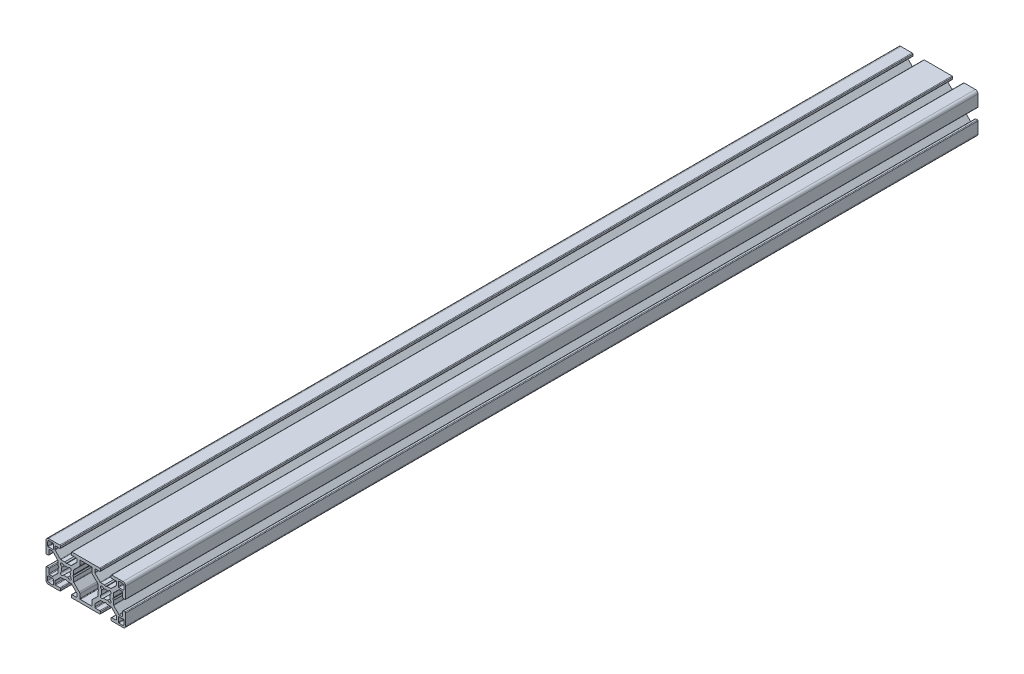
from build123d import *

# Parameters (mm, degrees)
EXTRUDE1_DEPTH = 642


with BuildPart() as part:
    # Sketch1 → Extrude1 (new body)
    with BuildSketch(Plane.XY):
        with BuildLine():
            Line((-10.428, -15), (10.428, -15))
            ThreePointArc((10.428, -15), (10.787210245, -14.851210245), (10.936, -14.492))
            Line((10.936, -14.492), (10.936, -13.2982))
            ThreePointArc((10.936, -13.2982), (10.787210245, -12.938989755), (10.428, -12.7902))
            Line((10.428, -12.7902), (7.253, -12.7902))
            ThreePointArc((7.253, -12.7902), (6.893789755, -12.641410245), (6.745, -12.2822))
            Line((6.745, -12.2822), (6.745, -10.261471714))
            ThreePointArc((6.745, -10.261471714), (6.783669197, -10.06706853), (6.893789755, -9.902261469))
            Line((6.893789755, -9.902261469), (10.825246067, -5.970805157))
            ThreePointArc((10.825246067, -5.970805157), (10.990053129, -5.860684599), (11.184456312, -5.822015402))
            Line((11.184456312, -5.822015402), (14.0475, -5.822015402))
            Line((14.0475, -5.822015402), (15, -5.314015402))
            Line((15, -5.314015402), (15.9525, -5.822015402))
            Line((15.9525, -5.822015402), (18.815543688, -5.822015402))
            ThreePointArc((18.815543688, -5.822015402), (19.009946871, -5.860684599), (19.174753933, -5.970805157))
            Line((19.174753933, -5.970805157), (23.106210245, -9.902261469))
            ThreePointArc((23.106210245, -9.902261469), (23.216330803, -10.06706853), (23.255, -10.261471714))
            Line((23.255, -10.261471714), (23.255, -12.2822))
            ThreePointArc((23.255, -12.2822), (23.106210245, -12.641410245), (22.747, -12.7902))
            Line((22.747, -12.7902), (19.572, -12.7902))
            ThreePointArc((19.572, -12.7902), (19.212789755, -12.938989755), (19.064, -13.2982))
            Line((19.064, -13.2982), (19.064, -14.492))
            ThreePointArc((19.064, -14.492), (19.212789755, -14.851210245), (19.572, -15))
            Line((19.572, -15), (27.9934, -15))
            ThreePointArc((27.9934, -15), (29.412280467, -14.412280467), (30, -12.9934))
            Line((30, -12.9934), (30, -4.572))
            ThreePointArc((30, -4.572), (29.851210245, -4.212789755), (29.492, -4.064))
            Line((29.492, -4.064), (28.2982, -4.064))
            ThreePointArc((28.2982, -4.064), (27.938989755, -4.212789755), (27.7902, -4.572))
            Line((27.7902, -4.572), (27.7902, -7.747))
            ThreePointArc((27.7902, -7.747), (27.641410245, -8.106210245), (27.2822, -8.255))
            Line((27.2822, -8.255), (25.261471714, -8.255))
            ThreePointArc((25.261471714, -8.255), (25.06706853, -8.216330803), (24.902261469, -8.106210245))
            Line((24.902261469, -8.106210245), (20.970805157, -4.174753933))
            ThreePointArc((20.970805157, -4.174753933), (20.860684599, -4.009946871), (20.822015402, -3.815543688))
            Line((20.822015402, -3.815543688), (20.822015402, -0.9525))
            Line((20.822015402, -0.9525), (20.314015402, 0))
            Line((20.314015402, 0), (20.822015402, 0.9525))
            Line((20.822015402, 0.9525), (20.822015402, 3.815543688))
            ThreePointArc((20.822015402, 3.815543688), (20.860684599, 4.009946871), (20.970805157, 4.174753933))
            Line((20.970805157, 4.174753933), (24.902261469, 8.106210245))
            ThreePointArc((24.902261469, 8.106210245), (25.06706853, 8.216330803), (25.261471714, 8.255))
            Line((25.261471714, 8.255), (27.2822, 8.255))
            ThreePointArc((27.2822, 8.255), (27.641410245, 8.106210245), (27.7902, 7.747))
            Line((27.7902, 7.747), (27.7902, 4.572))
            ThreePointArc((27.7902, 4.572), (27.938989755, 4.212789755), (28.2982, 4.064))
            Line((28.2982, 4.064), (29.492, 4.064))
            ThreePointArc((29.492, 4.064), (29.851210245, 4.212789755), (30, 4.572))
            Line((30, 4.572), (30, 12.9934))
            ThreePointArc((30, 12.9934), (29.412280467, 14.412280467), (27.9934, 15))
            Line((27.9934, 15), (19.572, 15))
            ThreePointArc((19.572, 15), (19.212789755, 14.851210245), (19.064, 14.492))
            Line((19.064, 14.492), (19.064, 13.2982))
            ThreePointArc((19.064, 13.2982), (19.212789755, 12.938989755), (19.572, 12.7902))
            Line((19.572, 12.7902), (22.747, 12.7902))
            ThreePointArc((22.747, 12.7902), (23.106210245, 12.641410245), (23.255, 12.2822))
            Line((23.255, 12.2822), (23.255, 10.261471714))
            ThreePointArc((23.255, 10.261471714), (23.216330803, 10.06706853), (23.106210245, 9.902261469))
            Line((23.106210245, 9.902261469), (19.174753933, 5.970805157))
            ThreePointArc((19.174753933, 5.970805157), (19.009946871, 5.860684599), (18.815543688, 5.822015402))
            Line((18.815543688, 5.822015402), (15.9525, 5.822015402))
            Line((15.9525, 5.822015402), (15, 5.314015402))
            Line((15, 5.314015402), (14.0475, 5.822015402))
            Line((14.0475, 5.822015402), (11.184456312, 5.822015402))
            ThreePointArc((11.184456312, 5.822015402), (10.990053129, 5.860684599), (10.825246067, 5.970805157))
            Line((10.825246067, 5.970805157), (6.893789755, 9.902261469))
            ThreePointArc((6.893789755, 9.902261469), (6.783669197, 10.06706853), (6.745, 10.261471714))
            Line((6.745, 10.261471714), (6.745, 12.2822))
            ThreePointArc((6.745, 12.2822), (6.893789755, 12.641410245), (7.253, 12.7902))
            Line((7.253, 12.7902), (10.428, 12.7902))
            ThreePointArc((10.428, 12.7902), (10.787210245, 12.938989755), (10.936, 13.2982))
            Line((10.936, 13.2982), (10.936, 14.492))
            ThreePointArc((10.936, 14.492), (10.787210245, 14.851210245), (10.428, 15))
            Line((10.428, 15), (-10.428, 15))
            ThreePointArc((-10.428, 15), (-10.787210245, 14.851210245), (-10.936, 14.492))
            Line((-10.936, 14.492), (-10.936, 13.2982))
            ThreePointArc((-10.936, 13.2982), (-10.787210245, 12.938989755), (-10.428, 12.7902))
            Line((-10.428, 12.7902), (-7.253, 12.7902))
            ThreePointArc((-7.253, 12.7902), (-6.893789755, 12.641410245), (-6.745, 12.2822))
            Line((-6.745, 12.2822), (-6.745, 10.261471714))
            ThreePointArc((-6.745, 10.261471714), (-6.783669197, 10.06706853), (-6.893789755, 9.902261469))
            Line((-6.893789755, 9.902261469), (-10.825246067, 5.970805157))
            ThreePointArc((-10.825246067, 5.970805157), (-10.990053129, 5.860684599), (-11.184456312, 5.822015402))
            Line((-11.184456312, 5.822015402), (-14.0475, 5.822015402))
            Line((-14.0475, 5.822015402), (-15, 5.314015402))
            Line((-15, 5.314015402), (-15.9525, 5.822015402))
            Line((-15.9525, 5.822015402), (-18.815543688, 5.822015402))
            ThreePointArc((-18.815543688, 5.822015402), (-19.009946871, 5.860684599), (-19.174753933, 5.970805157))
            Line((-19.174753933, 5.970805157), (-23.106210245, 9.902261469))
            ThreePointArc((-23.106210245, 9.902261469), (-23.216330803, 10.06706853), (-23.255, 10.261471714))
            Line((-23.255, 10.261471714), (-23.255, 12.2822))
            ThreePointArc((-23.255, 12.2822), (-23.106210245, 12.641410245), (-22.747, 12.7902))
            Line((-22.747, 12.7902), (-19.572, 12.7902))
            ThreePointArc((-19.572, 12.7902), (-19.212789755, 12.938989755), (-19.064, 13.2982))
            Line((-19.064, 13.2982), (-19.064, 14.492))
            ThreePointArc((-19.064, 14.492), (-19.212789755, 14.851210245), (-19.572, 15))
            Line((-19.572, 15), (-27.9934, 15))
            ThreePointArc((-27.9934, 15), (-29.412280467, 14.412280467), (-30, 12.9934))
            Line((-30, 12.9934), (-30, 4.572))
            ThreePointArc((-30, 4.572), (-29.851210245, 4.212789755), (-29.492, 4.064))
            Line((-29.492, 4.064), (-28.2982, 4.064))
            ThreePointArc((-28.2982, 4.064), (-27.938989755, 4.212789755), (-27.7902, 4.572))
            Line((-27.7902, 4.572), (-27.7902, 7.747))
            ThreePointArc((-27.7902, 7.747), (-27.641410245, 8.106210245), (-27.2822, 8.255))
            Line((-27.2822, 8.255), (-25.261471714, 8.255))
            ThreePointArc((-25.261471714, 8.255), (-25.06706853, 8.216330803), (-24.902261469, 8.106210245))
            Line((-24.902261469, 8.106210245), (-20.970805157, 4.174753933))
            ThreePointArc((-20.970805157, 4.174753933), (-20.860684599, 4.009946871), (-20.822015402, 3.815543688))
            Line((-20.822015402, 3.815543688), (-20.822015402, 0.9525))
            Line((-20.822015402, 0.9525), (-20.314015402, 0))
            Line((-20.314015402, 0), (-20.822015402, -0.9525))
            Line((-20.822015402, -0.9525), (-20.822015402, -3.815543688))
            ThreePointArc((-20.822015402, -3.815543688), (-20.860684599, -4.009946871), (-20.970805157, -4.174753933))
            Line((-20.970805157, -4.174753933), (-24.902261469, -8.106210245))
            ThreePointArc((-24.902261469, -8.106210245), (-25.06706853, -8.216330803), (-25.261471714, -8.255))
            Line((-25.261471714, -8.255), (-27.2822, -8.255))
            ThreePointArc((-27.2822, -8.255), (-27.641410245, -8.106210245), (-27.7902, -7.747))
            Line((-27.7902, -7.747), (-27.7902, -4.572))
            ThreePointArc((-27.7902, -4.572), (-27.938989755, -4.212789755), (-28.2982, -4.064))
            Line((-28.2982, -4.064), (-29.492, -4.064))
            ThreePointArc((-29.492, -4.064), (-29.851210245, -4.212789755), (-30, -4.572))
            Line((-30, -4.572), (-30, -12.9934))
            ThreePointArc((-30, -12.9934), (-29.412280467, -14.412280467), (-27.9934, -15))
            Line((-27.9934, -15), (-19.572, -15))
            ThreePointArc((-19.572, -15), (-19.212789755, -14.851210245), (-19.064, -14.492))
            Line((-19.064, -14.492), (-19.064, -13.2982))
            ThreePointArc((-19.064, -13.2982), (-19.212789755, -12.938989755), (-19.572, -12.7902))
            Line((-19.572, -12.7902), (-22.747, -12.7902))
            ThreePointArc((-22.747, -12.7902), (-23.106210245, -12.641410245), (-23.255, -12.2822))
            Line((-23.255, -12.2822), (-23.255, -10.261471714))
            ThreePointArc((-23.255, -10.261471714), (-23.216330803, -10.06706853), (-23.106210245, -9.902261469))
            Line((-23.106210245, -9.902261469), (-19.174753933, -5.970805157))
            ThreePointArc((-19.174753933, -5.970805157), (-19.009946871, -5.860684599), (-18.815543688, -5.822015402))
            Line((-18.815543688, -5.822015402), (-15.9525, -5.822015402))
            Line((-15.9525, -5.822015402), (-15, -5.314015402))
            Line((-15, -5.314015402), (-14.0475, -5.822015402))
            Line((-14.0475, -5.822015402), (-11.184456312, -5.822015402))
            ThreePointArc((-11.184456312, -5.822015402), (-10.990053129, -5.860684599), (-10.825246067, -5.970805157))
            Line((-10.825246067, -5.970805157), (-6.893789755, -9.902261469))
            ThreePointArc((-6.893789755, -9.902261469), (-6.783669197, -10.06706853), (-6.745, -10.261471714))
            Line((-6.745, -10.261471714), (-6.745, -12.2822))
            ThreePointArc((-6.745, -12.2822), (-6.893789755, -12.641410245), (-7.253, -12.7902))
            Line((-7.253, -12.7902), (-10.428, -12.7902))
            ThreePointArc((-10.428, -12.7902), (-10.787210245, -12.938989755), (-10.936, -13.2982))
            Line((-10.936, -13.2982), (-10.936, -14.492))
            ThreePointArc((-10.936, -14.492), (-10.787210245, -14.851210245), (-10.428, -15))
        make_face()
        with BuildLine():
            Line((12.782541514, 3.726141514), (13.525717665, 2.982965363))
            ThreePointArc((13.525717665, 2.982965363), (15, 3.3274), (16.474282335, 2.982965363))
            Line((16.474282335, 2.982965363), (17.217458486, 3.726141514))
            ThreePointArc((17.217458486, 3.726141514), (18.726141514, 3.726141514), (18.726141514, 2.217458486))
            Line((18.726141514, 2.217458486), (17.982965363, 1.474282335))
            ThreePointArc((17.982965363, 1.474282335), (18.3274, 0), (17.982965363, -1.474282335))
            Line((17.982965363, -1.474282335), (18.726141514, -2.217458486))
            ThreePointArc((18.726141514, -2.217458486), (18.726141514, -3.726141514), (17.217458486, -3.726141514))
            Line((17.217458486, -3.726141514), (16.474282335, -2.982965363))
            ThreePointArc((16.474282335, -2.982965363), (15, -3.3274), (13.525717665, -2.982965363))
            Line((13.525717665, -2.982965363), (12.782541514, -3.726141514))
            ThreePointArc((12.782541514, -3.726141514), (11.273858486, -3.726141514), (11.273858486, -2.217458486))
            Line((11.273858486, -2.217458486), (12.017034637, -1.474282335))
            ThreePointArc((12.017034637, -1.474282335), (11.6726, 0), (12.017034637, 1.474282335))
            Line((12.017034637, 1.474282335), (11.273858486, 2.217458486))
            ThreePointArc((11.273858486, 2.217458486), (11.273858486, 3.726141514), (12.782541514, 3.726141514))
        make_face(mode=Mode.SUBTRACT)
        with BuildLine():
            Line((-28.7046, 9.8946), (-28.7046, 12.6886))
            ThreePointArc((-28.7046, 12.6886), (-28.40702049, 13.40702049), (-27.6886, 13.7046))
            Line((-27.6886, 13.7046), (-24.8946, 13.7046))
            ThreePointArc((-24.8946, 13.7046), (-24.625192316, 13.593007684), (-24.5136, 13.3236))
            Line((-24.5136, 13.3236), (-24.5136, 9.8946))
            ThreePointArc((-24.5136, 9.8946), (-24.625192316, 9.625192316), (-24.8946, 9.5136))
            Line((-24.8946, 9.5136), (-28.3236, 9.5136))
            ThreePointArc((-28.3236, 9.5136), (-28.593007684, 9.625192316), (-28.7046, 9.8946))
        make_face(mode=Mode.SUBTRACT)
        with BuildLine():
            Line((-24.8946, -13.7046), (-27.6886, -13.7046))
            ThreePointArc((-27.6886, -13.7046), (-28.40702049, -13.40702049), (-28.7046, -12.6886))
            Line((-28.7046, -12.6886), (-28.7046, -9.8946))
            ThreePointArc((-28.7046, -9.8946), (-28.593007684, -9.625192316), (-28.3236, -9.5136))
            Line((-28.3236, -9.5136), (-24.8946, -9.5136))
            ThreePointArc((-24.8946, -9.5136), (-24.625192316, -9.625192316), (-24.5136, -9.8946))
            Line((-24.5136, -9.8946), (-24.5136, -13.3236))
            ThreePointArc((-24.5136, -13.3236), (-24.625192316, -13.593007684), (-24.8946, -13.7046))
        make_face(mode=Mode.SUBTRACT)
        with BuildLine():
            Line((4.981569265, 8.22237951), (9.029194843, 4.174753933))
            ThreePointArc((9.029194843, 4.174753933), (9.139315401, 4.009946871), (9.177984598, 3.815543688))
            Line((9.177984598, 3.815543688), (9.177984598, 0.9525))
            Line((9.177984598, 0.9525), (9.685984598, 0))
            Line((9.685984598, 0), (9.177984598, -0.9525))
            Line((9.177984598, -0.9525), (9.177984598, -3.815543688))
            ThreePointArc((9.177984598, -3.815543688), (9.139315401, -4.009946871), (9.029194843, -4.174753933))
            Line((9.029194843, -4.174753933), (4.981569265, -8.22237951))
            ThreePointArc((4.981569265, -8.22237951), (4.651207592, -8.716800694), (4.5352, -9.300010245))
            Line((4.5352, -9.300010245), (4.5352, -12.4092))
            ThreePointArc((4.5352, -12.4092), (4.423607684, -12.678607684), (4.1542, -12.7902))
            Line((4.1542, -12.7902), (-4.1542, -12.7902))
            ThreePointArc((-4.1542, -12.7902), (-4.423607684, -12.678607684), (-4.5352, -12.4092))
            Line((-4.5352, -12.4092), (-4.5352, -9.300010245))
            ThreePointArc((-4.5352, -9.300010245), (-4.651207592, -8.716800694), (-4.981569265, -8.22237951))
            Line((-4.981569265, -8.22237951), (-9.029194843, -4.174753933))
            ThreePointArc((-9.029194843, -4.174753933), (-9.139315401, -4.009946871), (-9.177984598, -3.815543688))
            Line((-9.177984598, -3.815543688), (-9.177984598, -0.9525))
            Line((-9.177984598, -0.9525), (-9.685984598, 0))
            Line((-9.685984598, 0), (-9.177984598, 0.9525))
            Line((-9.177984598, 0.9525), (-9.177984598, 3.815543688))
            ThreePointArc((-9.177984598, 3.815543688), (-9.139315401, 4.009946871), (-9.029194843, 4.174753933))
            Line((-9.029194843, 4.174753933), (-4.981569265, 8.22237951))
            ThreePointArc((-4.981569265, 8.22237951), (-4.651207592, 8.716800694), (-4.5352, 9.300010245))
            Line((-4.5352, 9.300010245), (-4.5352, 12.4092))
            ThreePointArc((-4.5352, 12.4092), (-4.423607684, 12.678607684), (-4.1542, 12.7902))
            Line((-4.1542, 12.7902), (4.1542, 12.7902))
            ThreePointArc((4.1542, 12.7902), (4.423607684, 12.678607684), (4.5352, 12.4092))
            Line((4.5352, 12.4092), (4.5352, 9.300010245))
            ThreePointArc((4.5352, 9.300010245), (4.651207592, 8.716800694), (4.981569265, 8.22237951))
        make_face(mode=Mode.SUBTRACT)
        with BuildLine():
            Line((-18.726141514, -2.217458486), (-17.982965363, -1.474282335))
            ThreePointArc((-17.982965363, -1.474282335), (-18.3274, 0), (-17.982965363, 1.474282335))
            Line((-17.982965363, 1.474282335), (-18.726141514, 2.217458486))
            ThreePointArc((-18.726141514, 2.217458486), (-18.726141514, 3.726141514), (-17.217458486, 3.726141514))
            Line((-17.217458486, 3.726141514), (-16.474282335, 2.982965363))
            ThreePointArc((-16.474282335, 2.982965363), (-15, 3.3274), (-13.525717665, 2.982965363))
            Line((-13.525717665, 2.982965363), (-12.782541514, 3.726141514))
            ThreePointArc((-12.782541514, 3.726141514), (-11.273858486, 3.726141514), (-11.273858486, 2.217458486))
            Line((-11.273858486, 2.217458486), (-12.017034637, 1.474282335))
            ThreePointArc((-12.017034637, 1.474282335), (-11.6726, 0), (-12.017034637, -1.474282335))
            Line((-12.017034637, -1.474282335), (-11.273858486, -2.217458486))
            ThreePointArc((-11.273858486, -2.217458486), (-11.273858486, -3.726141514), (-12.782541514, -3.726141514))
            Line((-12.782541514, -3.726141514), (-13.525717665, -2.982965363))
            ThreePointArc((-13.525717665, -2.982965363), (-15, -3.3274), (-16.474282335, -2.982965363))
            Line((-16.474282335, -2.982965363), (-17.217458486, -3.726141514))
            ThreePointArc((-17.217458486, -3.726141514), (-18.726141514, -3.726141514), (-18.726141514, -2.217458486))
        make_face(mode=Mode.SUBTRACT)
        with BuildLine():
            Line((24.8946, 13.7046), (27.6886, 13.7046))
            ThreePointArc((27.6886, 13.7046), (28.40702049, 13.40702049), (28.7046, 12.6886))
            Line((28.7046, 12.6886), (28.7046, 9.8946))
            ThreePointArc((28.7046, 9.8946), (28.593007684, 9.625192316), (28.3236, 9.5136))
            Line((28.3236, 9.5136), (24.8946, 9.5136))
            ThreePointArc((24.8946, 9.5136), (24.625192316, 9.625192316), (24.5136, 9.8946))
            Line((24.5136, 9.8946), (24.5136, 13.3236))
            ThreePointArc((24.5136, 13.3236), (24.625192316, 13.593007684), (24.8946, 13.7046))
        make_face(mode=Mode.SUBTRACT)
        with BuildLine():
            Line((24.5136, -13.3236), (24.5136, -9.8946))
            ThreePointArc((24.5136, -9.8946), (24.625192316, -9.625192316), (24.8946, -9.5136))
            Line((24.8946, -9.5136), (28.3236, -9.5136))
            ThreePointArc((28.3236, -9.5136), (28.593007684, -9.625192316), (28.7046, -9.8946))
            Line((28.7046, -9.8946), (28.7046, -12.6886))
            ThreePointArc((28.7046, -12.6886), (28.40702049, -13.40702049), (27.6886, -13.7046))
            Line((27.6886, -13.7046), (24.8946, -13.7046))
            ThreePointArc((24.8946, -13.7046), (24.625192316, -13.593007684), (24.5136, -13.3236))
        make_face(mode=Mode.SUBTRACT)
    extrude(amount=-EXTRUDE1_DEPTH)


solid = part.part
